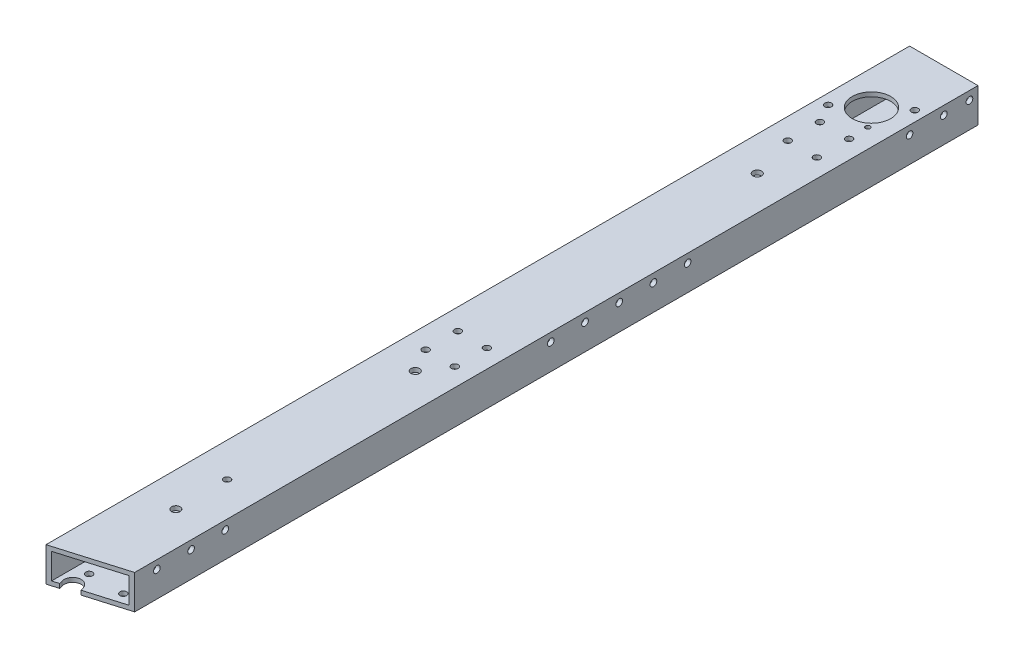
from build123d import *

# Parameters (mm, degrees)
BOSS_EXTRUDE1_DEPTH              = 320.675
BOSS_EXTRUDE1_DEPTH_BACK         = 320.675
SKETCH3_W                        = 50.8
SKETCH3_H                        = 25.4
SKETCH3_W_2                      = 44.45
SKETCH3_H_2                      = 19.05
CUT_EXTRUDE1_DEPTH               = 323.680609311
CUT_EXTRUDE1_DEPTH_BACK          = 323.680609311
SKETCH8_R                        = 14.2875
CUT_EXTRUDE2_DEPTH               = 323.680609311
F_10_CLEARANCE_HOLE1_D           = 4.9784
F_10_CLEARANCE_HOLE1_DEPTH       = 5.08
F_10_CLEARANCE_HOLE1_TIP         = 1.495662253
F_10_CLEARANCE_HOLE2_D           = 4.9784
F_10_CLEARANCE_HOLE3_D           = 4.9784
F_10_CLEARANCE_HOLE4_D           = 4.9784
F_10_CLEARANCE_HOLE4_DEPTH       = 5.08
F_10_CLEARANCE_HOLE4_TIP         = 1.495662253
F_10_CLEARANCE_HOLE5_D           = 4.9784
TAP_DRILL_FOR_8_32_TAP1_D        = 3.4544
F_10_CLEARANCE_HOLE6_AT_2_COUNT  = 2
F_10_CLEARANCE_HOLE6_AT_2_PITCH  = 21.6408
F_10_CLEARANCE_HOLE6_AT_3_COUNT  = 2
F_10_CLEARANCE_HOLE6_AT_3_PITCH  = 32.224022105
F_10_CLEARANCE_HOLE6_AT_4_COUNT  = 2
F_10_CLEARANCE_HOLE6_AT_4_PITCH  = 23.876
F_10_CLEARANCE_HOLE6_AT_5_COUNT  = 2
F_10_CLEARANCE_HOLE6_AT_5_PITCH  = 269.79183685
F_10_CLEARANCE_HOLE6_AT_6_COUNT  = 2
F_10_CLEARANCE_HOLE6_AT_6_PITCH  = 268.9225
F_10_CLEARANCE_HOLE6_AT_7_COUNT  = 2
F_10_CLEARANCE_HOLE6_AT_7_PITCH  = 292.7985
F_10_CLEARANCE_HOLE6_AT_8_COUNT  = 2
F_10_CLEARANCE_HOLE6_AT_8_PITCH  = 293.597148874
F_10_0_1935_DIAMETER_HOLE1_D     = 4.9149
F_10_0_1935_DIAMETER_HOLE1_DEPTH = 3.302
F_10_0_1935_DIAMETER_HOLE1_TIP   = 1.476584928
CUT_EXTRUDE4_DEPTH               = 5.08
F_1_4_0_25_DIAMETER_HOLE1_D      = 6.35


with BuildPart() as part:
    # Sketch3 → Boss-Extrude1 (new, two sides: drawn at the far end of the back side and taken through both)
    with BuildSketch(Plane.XY.offset(-BOSS_EXTRUDE1_DEPTH_BACK)):
        Rectangle(SKETCH3_W, SKETCH3_H)
        Rectangle(SKETCH3_W_2, SKETCH3_H_2, mode=Mode.SUBTRACT)
    extrude(amount=BOSS_EXTRUDE1_DEPTH + BOSS_EXTRUDE1_DEPTH_BACK)

    # Sketch4 → Cut-Extrude1 (cut, two sides: drawn at the far end of the back side and taken through both)
    with BuildSketch(Plane(origin=(0, 12.7, 0), x_dir=(1, 0, 0), z_dir=(0, 1, 0)).offset(-CUT_EXTRUDE1_DEPTH_BACK)):
        Polygon((1322.117470931, -320.675), (25.4, -320.675), (-25.4, -320.675), (25.4, -305.627354456), (1268.718301677, 62.660305034), (3837.350959621, 420.474595165), (3890.750128875, 37.139290131), align=None)
    extrude(amount=CUT_EXTRUDE1_DEPTH + CUT_EXTRUDE1_DEPTH_BACK, mode=Mode.SUBTRACT)

    # Sketch8 → Cut-Extrude2 (cut, through all)
    with BuildSketch(Plane(origin=(0, 12.7, 0), x_dir=(1, 0, 0), z_dir=(0, 1, 0))):
        with Locations(Location((0, 266.954, 0), (0, 0, 180))):
            Circle(SKETCH8_R)
    extrude(amount=-CUT_EXTRUDE2_DEPTH, mode=Mode.SUBTRACT)

    # #10 Clearance Hole1
    with Locations(Plane(origin=(0, -12.7, 0), x_dir=(-1, 0, 0), z_dir=(0, -1, 0))):
        with Locations((-12.6238, -284.753033923), (12.7762, -284.753033923), (12.7762, -301.263033923), (-12.6238, -301.263033923)):
            Hole(F_10_CLEARANCE_HOLE1_D / 2, depth=F_10_CLEARANCE_HOLE1_DEPTH)
            with Locations((0, 0, -(F_10_CLEARANCE_HOLE1_DEPTH + F_10_CLEARANCE_HOLE1_TIP / 2))):  # 118° drill point
                Cone(0, F_10_CLEARANCE_HOLE1_D / 2, F_10_CLEARANCE_HOLE1_TIP, mode=Mode.SUBTRACT)

    # #10 Clearance Hole2 (through all)
    with Locations(Plane(origin=(25.4, 0, 0), x_dir=(0, 0, -1), z_dir=(1, 0, 0))):
        with Locations((314.325, 6.35), (295.275, 6.35)):
            Hole(F_10_CLEARANCE_HOLE2_D / 2)

    # #10 Clearance Hole3 (through all)
    with Locations(Plane(origin=(25.4, 0, 0), x_dir=(0, 0, -1), z_dir=(1, 0, 0))):
        with Locations((105.029, 6.35), (79.629, 6.35), (54.229, 6.35), (28.829, 6.35), (3.429, 6.35), (-289.126683504, 6.388229415), (-263.726683504, 6.388229415), (-238.326683504, 6.388229415)):
            Hole(F_10_CLEARANCE_HOLE3_D / 2)

    # #10 Clearance Hole4
    with Locations(Plane(origin=(0, 12.7, 0), x_dir=(1, 0, 0), z_dir=(0, 1, 0))):
        with Locations((17.786, 281.371028265), (-17.786, 252.536971735)):
            Hole(F_10_CLEARANCE_HOLE4_D / 2, depth=F_10_CLEARANCE_HOLE4_DEPTH)
            with Locations((0, 0, -(F_10_CLEARANCE_HOLE4_DEPTH + F_10_CLEARANCE_HOLE4_TIP / 2))):  # 118° drill point
                Cone(0, F_10_CLEARANCE_HOLE4_D / 2, F_10_CLEARANCE_HOLE4_TIP, mode=Mode.SUBTRACT)

    # #10 Clearance Hole5 (through all)
    with Locations(Plane(origin=(0, 12.7, 0), x_dir=(1, 0, 0), z_dir=(0, 1, 0))):
        with Locations((-0.0762, -211.551177228)):
            Hole(F_10_CLEARANCE_HOLE5_D / 2)

    # Tap Drill for #8-32 Tap1 (through all)
    with Locations(Plane(origin=(0, 12.7, 0), x_dir=(1, 0, 0), z_dir=(0, 1, 0))):
        with Locations((11.355922339, 252.94442528)):
            Hole(TAP_DRILL_FOR_8_32_TAP1_D / 2)

    # Sketch27 → #10 Clearance Hole6 (revolve, cut)
    with BuildSketch(Plane(origin=(-9.795655012, 12.7, -238.47425), x_dir=(0, 0, 1), z_dir=(1, 0, 0))):
        Polygon((0, 0), (0, 25.4), (5.2197, 25.4), (2.4892, 22.258919064), (2.4892, 0), align=None)
    f_10_clearance_hole6 = revolve(axis=Axis((-9.795655012, 19.05, -238.47425), (0, -1, 0)), mode=Mode.SUBTRACT)

    # #10 Clearance Hole6 at 2: #10 Clearance Hole6 ×2
    with Locations(*[(i * F_10_CLEARANCE_HOLE6_AT_2_PITCH, 0, 0) for i in range(1, F_10_CLEARANCE_HOLE6_AT_2_COUNT)]):
        add(f_10_clearance_hole6, mode=Mode.SUBTRACT)

    # #10 Clearance Hole6 at 3: #10 Clearance Hole6 ×2
    with Locations(*[Vector(0.6715735214342003, 0, 0.7409379227090943) * (i * F_10_CLEARANCE_HOLE6_AT_3_PITCH) for i in range(1, F_10_CLEARANCE_HOLE6_AT_3_COUNT)]):
        add(f_10_clearance_hole6, mode=Mode.SUBTRACT)

    # #10 Clearance Hole6 at 4: #10 Clearance Hole6 ×2
    with Locations(*[(0, 0, i * F_10_CLEARANCE_HOLE6_AT_4_PITCH) for i in range(1, F_10_CLEARANCE_HOLE6_AT_4_COUNT)]):
        add(f_10_clearance_hole6, mode=Mode.SUBTRACT)

    # #10 Clearance Hole6 at 5: #10 Clearance Hole6 ×2
    with Locations(*[Vector(0.08021295326304838, 0, 0.9967777496156403) * (i * F_10_CLEARANCE_HOLE6_AT_5_PITCH) for i in range(1, F_10_CLEARANCE_HOLE6_AT_5_COUNT)]):
        add(f_10_clearance_hole6, mode=Mode.SUBTRACT)

    # #10 Clearance Hole6 at 6: #10 Clearance Hole6 ×2
    with Locations(*[(0, 0, i * F_10_CLEARANCE_HOLE6_AT_6_PITCH) for i in range(1, F_10_CLEARANCE_HOLE6_AT_6_COUNT)]):
        add(f_10_clearance_hole6, mode=Mode.SUBTRACT)

    # #10 Clearance Hole6 at 7: #10 Clearance Hole6 ×2
    with Locations(*[(0, 0, i * F_10_CLEARANCE_HOLE6_AT_7_PITCH) for i in range(1, F_10_CLEARANCE_HOLE6_AT_7_COUNT)]):
        add(f_10_clearance_hole6, mode=Mode.SUBTRACT)

    # #10 Clearance Hole6 at 8: #10 Clearance Hole6 ×2
    with Locations(*[Vector(0.07370916265026073, 0, 0.9972797798719262) * (i * F_10_CLEARANCE_HOLE6_AT_8_PITCH) for i in range(1, F_10_CLEARANCE_HOLE6_AT_8_COUNT)]):
        add(f_10_clearance_hole6, mode=Mode.SUBTRACT)

    # #10 (0.1935) Diameter Hole1
    with Locations(Plane(origin=(25.4, 0, 0), x_dir=(0, 0, -1), z_dir=(1, 0, 0))):
        with Locations((269.875, 6.35)):
            Hole(F_10_0_1935_DIAMETER_HOLE1_D / 2, depth=F_10_0_1935_DIAMETER_HOLE1_DEPTH)
            with Locations((0, 0, -(F_10_0_1935_DIAMETER_HOLE1_DEPTH + F_10_0_1935_DIAMETER_HOLE1_TIP / 2))):  # 118° drill point
                Cone(0, F_10_0_1935_DIAMETER_HOLE1_D / 2, F_10_0_1935_DIAMETER_HOLE1_TIP, mode=Mode.SUBTRACT)

    # Sketch30 → Cut-Extrude4 (cut)
    with BuildSketch(Plane(origin=(0, -12.7, 0), x_dir=(1, 0, 0), z_dir=(0, 1, 0))):
        with BuildLine():
            Line((-17.533651131, -318.344881309), (-5.356640498, -314.737886431))
            Line((-5.356640498, -314.737886431), (-6.078039474, -312.302484305))
            ThreePointArc((-6.078039474, -312.302484305), (-13.970042229, -308.017476427), (-18.255050107, -315.909479182))
            Line((-18.255050107, -315.909479182), (-17.533651131, -318.344881309))
        make_face()
    extrude(amount=CUT_EXTRUDE4_DEPTH, mode=Mode.SUBTRACT)

    # 1/4 (0.25) Diameter Hole1 (through all)
    with Locations(Plane(origin=(0, 12.7, 0), x_dir=(1, 0, 0), z_dir=(0, 1, 0))):
        with Locations((0, -71.851177228), (0, -249.651177228), (0, 182.148822772)):
            Hole(F_1_4_0_25_DIAMETER_HOLE1_D / 2)


solid = part.part
